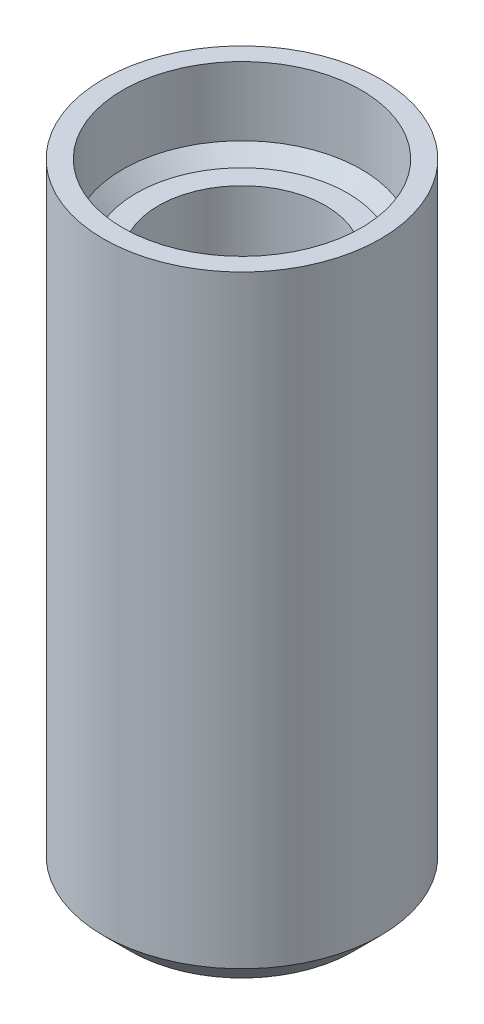
from build123d import *

# Parameters (mm, degrees)
SKETCH1_R           = 5.05
BOSS_EXTRUDE1_DEPTH = 20
SKETCH2_R           = 5.05
BOSS_EXTRUDE2_DEPTH = 2
SKETCH4_R           = 5.05
SKETCH4_R_2         = 4.35
BOSS_EXTRUDE3_DEPTH = 3
CHAMFER1_SIZE       = 1
CHAMFER2_SIZE       = 0.5
CUT_EXTRUDE1_DEPTH  = 0.4
BOSS_EXTRUDE4_DEPTH = 0.4


with BuildPart() as part:
    # Sketch1 → Boss-Extrude1 (new body)
    with BuildSketch(Plane(origin=(0, 0, 0), x_dir=(1, 0, 0), z_dir=(0, 1, 0))):
        Circle(SKETCH1_R)
        with BuildLine():
            Line((2.565151068, -1.65), (-2.565151068, -1.65))
            ThreePointArc((-2.565151068, -1.65), (0, 3.05), (2.565151068, -1.65))
        make_face(mode=Mode.SUBTRACT)
    extrude(amount=BOSS_EXTRUDE1_DEPTH)

    # Sketch2 → Boss-Extrude2 (add)
    with BuildSketch(Plane.XZ):
        Circle(SKETCH2_R)
    extrude(amount=-BOSS_EXTRUDE2_DEPTH)

    # Sketch4 → Boss-Extrude3 (add)
    with BuildSketch(Plane(origin=(0, 20, 0), x_dir=(1, 0, 0), z_dir=(0, 1, 0))):
        Circle(SKETCH4_R)
        Circle(SKETCH4_R_2, mode=Mode.SUBTRACT)
    extrude(amount=BOSS_EXTRUDE3_DEPTH)

    # Chamfer1
    chamfer1_edges = [part.edges().sort_by_distance(p)[0] for p in [
        (-5.05, 0, 0),
    ]]
    chamfer(chamfer1_edges, length=CHAMFER1_SIZE)

    # Chamfer2
    chamfer2_edges = [part.edges().sort_by_distance(p)[0] for p in [
        (-4.35, 20, 0),
    ]]
    chamfer(chamfer2_edges, length=CHAMFER2_SIZE)

    # Sketch5 → Cut-Extrude1 (cut)
    with BuildSketch(Plane.XZ):
        with BuildLine():
            add(Edge.make_bspline(
                [(1.439948587, -0.579050735), (1.438393197, -0.636125697), (1.435351129, -0.747754244), (1.412109355, -0.910724919), (1.373272888, -1.064316235), (1.318915978, -1.208054895), (1.251228015, -1.341503154), (1.168775155, -1.463629965), (1.075220295, -1.576249809), (0.967079513, -1.676505714), (0.847543719, -1.765655745), (0.716616536, -1.844185545), (0.574047546, -1.910923319), (0.420839367, -1.966886317), (0.257910597, -2.010815218), (0.085582122, -2.041361107), (-0.09520692, -2.060989849), (-0.218939729, -2.062982384), (-0.281989932, -2.063997715)],
                knots=[0, 0, 0, 0, 1.06697082, 2.086806491, 3.070914618, 4.02363306, 4.954656601, 5.862205625, 6.773556322, 7.686376441, 8.612568136, 9.557486927, 10.536112515, 11.55159642, 12.603902796, 13.687080049, 14.821411453, 16, 16, 16, 16], degree=3))
            add(Edge.make_bspline(
                [(-0.281989932, -2.063997715), (-0.348356836, -2.062827871), (-0.477649342, -2.060548843), (-0.665044022, -2.04349323), (-0.837747996, -2.016303457), (-0.992433846, -1.984355765), (-1.123968139, -1.94757722), (-1.217306518, -1.916285097), (-1.278293624, -1.892493495), (-1.312122515, -1.875368598), (-1.339664896, -1.861712222), (-1.363906932, -1.843835105), (-1.385501075, -1.820189227), (-1.404423487, -1.789260602), (-1.415744932, -1.75341174), (-1.426467821, -1.712510457), (-1.432590839, -1.662801927), (-1.438004466, -1.602800041), (-1.439033403, -1.531346414), (-1.439629456, -1.479681351), (-1.439948587, -1.452019566)],
                knots=[0, 0, 0, 0, 2.352153803, 4.582342044, 6.662667079, 8.546514862, 10.177514967, 11.500105838, 12.035421318, 12.4951253, 12.844003289, 13.122835489, 13.557570542, 13.970909211, 14.396887048, 14.884011341, 15.46879923, 16.168353294, 17.019325374, 18, 18, 18, 18], degree=3))
            add(Edge.make_bspline(
                [(-1.439948587, -1.452019566), (-1.439391637, -1.422021975), (-1.438376195, -1.367329788), (-1.435474416, -1.292072513), (-1.426872986, -1.23103092), (-1.41409825, -1.182479098), (-1.397910532, -1.14616854), (-1.378219461, -1.120833075), (-1.354577758, -1.1060704), (-1.33746784, -1.104709356), (-1.32895255, -1.10403199)],
                knots=[0, 0, 0, 0, 1.822902001, 3.323550125, 4.572139576, 5.559599618, 6.365772599, 6.969872283, 7.487324433, 8, 8, 8, 8], degree=3))
            add(Edge.make_bspline(
                [(-1.32895255, -1.10403199), (-1.314380115, -1.106692494), (-1.277664883, -1.113395629), (-1.219394697, -1.14876137), (-1.139980309, -1.189907738), (-1.037695887, -1.236395845), (-0.91190538, -1.281593663), (-0.791459343, -1.316487465), (-0.681740999, -1.338209641), (-0.588351478, -1.351644763), (-0.486730641, -1.357822159), (-0.416323331, -1.359273711), (-0.379986433, -1.36002285)],
                knots=[0, 0, 0, 0, 0.444011661, 1.118686809, 2.027427457, 3.152785246, 4.501835654, 6.058794642, 6.93060907, 7.875047181, 8.903321363, 10, 10, 10, 10], degree=3))
            add(Edge.make_bspline(
                [(-0.379986433, -1.36002285), (-0.31788032, -1.358275737), (-0.198485696, -1.354917036), (-0.053670925, -1.329255577), (0.051276255, -1.296118816), (0.123576356, -1.268409696), (0.188330585, -1.231138855), (0.247612541, -1.189342021), (0.301075979, -1.141322813), (0.346942768, -1.086622051), (0.387750954, -1.027445409), (0.420403557, -0.961544364), (0.448320421, -0.889922915), (0.466502796, -0.81112557), (0.477729401, -0.725703442), (0.479211121, -0.666752696), (0.479982862, -0.6360487)],
                knots=[0, 0, 0, 0, 2.032782473, 3.907880992, 4.788067796, 5.635158135, 6.436515337, 7.226873511, 8.007222909, 8.781366493, 9.559270127, 10.354810048, 11.183780612, 12.070505633, 12.995039183, 14, 14, 14, 14], degree=3))
            add(Edge.make_bspline(
                [(0.479982862, -0.6360487), (0.479412985, -0.6093624), (0.478305392, -0.557495903), (0.469563532, -0.482034449), (0.453177222, -0.411500625), (0.431432346, -0.344900313), (0.402538508, -0.283128781), (0.366916596, -0.225828092), (0.324085716, -0.17377282), (0.272905228, -0.127675559), (0.215793236, -0.084689087), (0.149399045, -0.049317465), (0.075561613, -0.019325372), (-0.005965992, 0.005981896), (-0.096158935, 0.024190829), (-0.194931474, 0.038548679), (-0.302874198, 0.046046446), (-0.377976858, 0.047284062), (-0.416985112, 0.047926879)],
                knots=[0, 0, 0, 0, 0.990747943, 1.925580712, 2.814217929, 3.675193293, 4.522270198, 5.339531786, 6.174590224, 7.015406179, 7.891633713, 8.822032467, 9.798768499, 10.847855848, 11.98621392, 13.211340836, 14.551572957, 16, 16, 16, 16], degree=3))
            add(Edge.make_bspline(
                [(-0.416985112, 0.047926879), (-0.478702682, 0.047210663), (-0.596668893, 0.045841696), (-0.765068195, 0.028934291), (-0.919926324, 0.01066173), (-1.019577939, 0.008821699), (-1.067961869, 0.007928307)],
                knots=[0, 0, 0, 0, 1.134417109, 2.168311031, 3.110658559, 4, 4, 4, 4], degree=3))
            add(Edge.make_bspline(
                [(-1.067961869, 0.007928307), (-1.083020531, 0.008392878), (-1.111118239, 0.009259712), (-1.150138262, 0.018431019), (-1.182818227, 0.032872851), (-1.209177811, 0.05548653), (-1.226922392, 0.087363767), (-1.240169466, 0.127638843), (-1.245874592, 0.177776437), (-1.2472265, 0.21425253), (-1.247955442, 0.233920238)],
                knots=[0, 0, 0, 0, 1.070487309, 1.997404571, 2.836260287, 3.593209122, 4.423627128, 5.399401485, 6.59777159, 8, 8, 8, 8], degree=3))
            Line((-1.247955442, 0.233920238), (-1.247955442, 2.102853508))
            add(Edge.make_bspline(
                [(-1.247955442, 2.102853508), (-1.247599976, 2.123576244), (-1.246941269, 2.16197712), (-1.236732112, 2.214876364), (-1.221311877, 2.259127895), (-1.197941013, 2.294775722), (-1.165564434, 2.320945401), (-1.126711766, 2.339974478), (-1.079383337, 2.349443274), (-1.045997006, 2.351002434), (-1.027963297, 2.351844618)],
                knots=[0, 0, 0, 0, 1.291048597, 2.392415675, 3.346680984, 4.200455207, 5.012683301, 5.914987328, 6.873775246, 8, 8, 8, 8], degree=3))
            Line((-1.027963297, 2.351844618), (1.04496269, 2.351844618))
            add(Edge.make_bspline(
                [(1.04496269, 2.351844618), (1.055190007, 2.350926617), (1.076261775, 2.349035221), (1.104894282, 2.331034015), (1.131333877, 2.304065643), (1.150121646, 2.263110254), (1.16654453, 2.210872955), (1.176134645, 2.144447296), (1.183468776, 2.063693255), (1.183785339, 2.004883661), (1.183957727, 1.97285815)],
                knots=[0, 0, 0, 0, 0.553923566, 1.141271771, 1.798199546, 2.596456404, 3.569952235, 4.788584081, 6.251182718, 8, 8, 8, 8], degree=3))
            add(Edge.make_bspline(
                [(1.183957727, 1.97285815), (1.183729472, 1.941175572), (1.183303526, 1.882052545), (1.176380949, 1.800537041), (1.165959332, 1.732820566), (1.151442781, 1.678865964), (1.132612223, 1.636851912), (1.108692381, 1.606959559), (1.079866993, 1.587443271), (1.058560376, 1.585058307), (1.047962583, 1.583872038)],
                knots=[0, 0, 0, 0, 1.705538939, 3.182715304, 4.401402576, 5.39006858, 6.184910218, 6.860567929, 7.433252789, 8, 8, 8, 8], degree=3))
            Line((1.047962583, 1.583872038), (-0.479982862, 1.583872038))
            Line((-0.479982862, 1.583872038), (-0.479982862, 0.667904743))
            add(Edge.make_bspline(
                [(-0.479982862, 0.667904743), (-0.441346593, 0.671918223), (-0.364857454, 0.679863805), (-0.248720081, 0.685708044), (-0.130332428, 0.686983289), (-0.049998012, 0.687592911), (-0.008999679, 0.687904029)],
                knots=[0, 0, 0, 0, 0.98809062, 1.956146446, 2.956927895, 4, 4, 4, 4], degree=3))
            add(Edge.make_bspline(
                [(-0.008999679, 0.687904029), (0.047360881, 0.686958258), (0.157291086, 0.68511355), (0.317154001, 0.670422458), (0.467180499, 0.644188125), (0.607480319, 0.608622662), (0.737597185, 0.56258046), (0.858039732, 0.507710012), (0.967040457, 0.441818615), (1.064846172, 0.365836383), (1.152941218, 0.282029844), (1.228161184, 0.186488915), (1.293613642, 0.082555145), (1.346679341, -0.031843243), (1.388761263, -0.155148579), (1.418518229, -0.288234642), (1.436738318, -0.430548976), (1.438859317, -0.528662904), (1.439948587, -0.579050735)],
                knots=[0, 0, 0, 0, 1.233638519, 2.406188574, 3.509786213, 4.564519873, 5.570688591, 6.527218667, 7.456964246, 8.351604632, 9.23399176, 10.111417538, 11.006266177, 11.916948856, 12.865290053, 13.852981671, 14.897367593, 16, 16, 16, 16], degree=3))
        make_face()
    extrude(amount=-CUT_EXTRUDE1_DEPTH, mode=Mode.SUBTRACT)


with BuildPart() as body_2:
    # Sketch5<2> → Boss-Extrude4 (new body)
    with BuildSketch(Plane.XZ):
        with BuildLine():
            add(Edge.make_bspline(
                [(1.439948587, -0.579050735), (1.438393197, -0.636125697), (1.435351129, -0.747754244), (1.412109355, -0.910724919), (1.373272888, -1.064316235), (1.318915978, -1.208054895), (1.251228015, -1.341503154), (1.168775155, -1.463629965), (1.075220295, -1.576249809), (0.967079513, -1.676505714), (0.847543719, -1.765655745), (0.716616536, -1.844185545), (0.574047546, -1.910923319), (0.420839367, -1.966886317), (0.257910597, -2.010815218), (0.085582122, -2.041361107), (-0.09520692, -2.060989849), (-0.218939729, -2.062982384), (-0.281989932, -2.063997715)],
                knots=[0, 0, 0, 0, 1.06697082, 2.086806491, 3.070914618, 4.02363306, 4.954656601, 5.862205625, 6.773556322, 7.686376441, 8.612568136, 9.557486927, 10.536112515, 11.55159642, 12.603902796, 13.687080049, 14.821411453, 16, 16, 16, 16], degree=3))
            add(Edge.make_bspline(
                [(-0.281989932, -2.063997715), (-0.348356836, -2.062827871), (-0.477649342, -2.060548843), (-0.665044022, -2.04349323), (-0.837747996, -2.016303457), (-0.992433846, -1.984355765), (-1.123968139, -1.94757722), (-1.217306518, -1.916285097), (-1.278293624, -1.892493495), (-1.312122515, -1.875368598), (-1.339664896, -1.861712222), (-1.363906932, -1.843835105), (-1.385501075, -1.820189227), (-1.404423487, -1.789260602), (-1.415744932, -1.75341174), (-1.426467821, -1.712510457), (-1.432590839, -1.662801927), (-1.438004466, -1.602800041), (-1.439033403, -1.531346414), (-1.439629456, -1.479681351), (-1.439948587, -1.452019566)],
                knots=[0, 0, 0, 0, 2.352153803, 4.582342044, 6.662667079, 8.546514862, 10.177514967, 11.500105838, 12.035421318, 12.4951253, 12.844003289, 13.122835489, 13.557570542, 13.970909211, 14.396887048, 14.884011341, 15.46879923, 16.168353294, 17.019325374, 18, 18, 18, 18], degree=3))
            add(Edge.make_bspline(
                [(-1.439948587, -1.452019566), (-1.439391637, -1.422021975), (-1.438376195, -1.367329788), (-1.435474416, -1.292072513), (-1.426872986, -1.23103092), (-1.41409825, -1.182479098), (-1.397910532, -1.14616854), (-1.378219461, -1.120833075), (-1.354577758, -1.1060704), (-1.33746784, -1.104709356), (-1.32895255, -1.10403199)],
                knots=[0, 0, 0, 0, 1.822902001, 3.323550125, 4.572139576, 5.559599618, 6.365772599, 6.969872283, 7.487324433, 8, 8, 8, 8], degree=3))
            add(Edge.make_bspline(
                [(-1.32895255, -1.10403199), (-1.314380115, -1.106692494), (-1.277664883, -1.113395629), (-1.219394697, -1.14876137), (-1.139980309, -1.189907738), (-1.037695887, -1.236395845), (-0.91190538, -1.281593663), (-0.791459343, -1.316487465), (-0.681740999, -1.338209641), (-0.588351478, -1.351644763), (-0.486730641, -1.357822159), (-0.416323331, -1.359273711), (-0.379986433, -1.36002285)],
                knots=[0, 0, 0, 0, 0.444011661, 1.118686809, 2.027427457, 3.152785246, 4.501835654, 6.058794642, 6.93060907, 7.875047181, 8.903321363, 10, 10, 10, 10], degree=3))
            add(Edge.make_bspline(
                [(-0.379986433, -1.36002285), (-0.31788032, -1.358275737), (-0.198485696, -1.354917036), (-0.053670925, -1.329255577), (0.051276255, -1.296118816), (0.123576356, -1.268409696), (0.188330585, -1.231138855), (0.247612541, -1.189342021), (0.301075979, -1.141322813), (0.346942768, -1.086622051), (0.387750954, -1.027445409), (0.420403557, -0.961544364), (0.448320421, -0.889922915), (0.466502796, -0.81112557), (0.477729401, -0.725703442), (0.479211121, -0.666752696), (0.479982862, -0.6360487)],
                knots=[0, 0, 0, 0, 2.032782473, 3.907880992, 4.788067796, 5.635158135, 6.436515337, 7.226873511, 8.007222909, 8.781366493, 9.559270127, 10.354810048, 11.183780612, 12.070505633, 12.995039183, 14, 14, 14, 14], degree=3))
            add(Edge.make_bspline(
                [(0.479982862, -0.6360487), (0.479412985, -0.6093624), (0.478305392, -0.557495903), (0.469563532, -0.482034449), (0.453177222, -0.411500625), (0.431432346, -0.344900313), (0.402538508, -0.283128781), (0.366916596, -0.225828092), (0.324085716, -0.17377282), (0.272905228, -0.127675559), (0.215793236, -0.084689087), (0.149399045, -0.049317465), (0.075561613, -0.019325372), (-0.005965992, 0.005981896), (-0.096158935, 0.024190829), (-0.194931474, 0.038548679), (-0.302874198, 0.046046446), (-0.377976858, 0.047284062), (-0.416985112, 0.047926879)],
                knots=[0, 0, 0, 0, 0.990747943, 1.925580712, 2.814217929, 3.675193293, 4.522270198, 5.339531786, 6.174590224, 7.015406179, 7.891633713, 8.822032467, 9.798768499, 10.847855848, 11.98621392, 13.211340836, 14.551572957, 16, 16, 16, 16], degree=3))
            add(Edge.make_bspline(
                [(-0.416985112, 0.047926879), (-0.478702682, 0.047210663), (-0.596668893, 0.045841696), (-0.765068195, 0.028934291), (-0.919926324, 0.01066173), (-1.019577939, 0.008821699), (-1.067961869, 0.007928307)],
                knots=[0, 0, 0, 0, 1.134417109, 2.168311031, 3.110658559, 4, 4, 4, 4], degree=3))
            add(Edge.make_bspline(
                [(-1.067961869, 0.007928307), (-1.083020531, 0.008392878), (-1.111118239, 0.009259712), (-1.150138262, 0.018431019), (-1.182818227, 0.032872851), (-1.209177811, 0.05548653), (-1.226922392, 0.087363767), (-1.240169466, 0.127638843), (-1.245874592, 0.177776437), (-1.2472265, 0.21425253), (-1.247955442, 0.233920238)],
                knots=[0, 0, 0, 0, 1.070487309, 1.997404571, 2.836260287, 3.593209122, 4.423627128, 5.399401485, 6.59777159, 8, 8, 8, 8], degree=3))
            Line((-1.247955442, 0.233920238), (-1.247955442, 2.102853508))
            add(Edge.make_bspline(
                [(-1.247955442, 2.102853508), (-1.247599976, 2.123576244), (-1.246941269, 2.16197712), (-1.236732112, 2.214876364), (-1.221311877, 2.259127895), (-1.197941013, 2.294775722), (-1.165564434, 2.320945401), (-1.126711766, 2.339974478), (-1.079383337, 2.349443274), (-1.045997006, 2.351002434), (-1.027963297, 2.351844618)],
                knots=[0, 0, 0, 0, 1.291048597, 2.392415675, 3.346680984, 4.200455207, 5.012683301, 5.914987328, 6.873775246, 8, 8, 8, 8], degree=3))
            Line((-1.027963297, 2.351844618), (1.04496269, 2.351844618))
            add(Edge.make_bspline(
                [(1.04496269, 2.351844618), (1.055190007, 2.350926617), (1.076261775, 2.349035221), (1.104894282, 2.331034015), (1.131333877, 2.304065643), (1.150121646, 2.263110254), (1.16654453, 2.210872955), (1.176134645, 2.144447296), (1.183468776, 2.063693255), (1.183785339, 2.004883661), (1.183957727, 1.97285815)],
                knots=[0, 0, 0, 0, 0.553923566, 1.141271771, 1.798199546, 2.596456404, 3.569952235, 4.788584081, 6.251182718, 8, 8, 8, 8], degree=3))
            add(Edge.make_bspline(
                [(1.183957727, 1.97285815), (1.183729472, 1.941175572), (1.183303526, 1.882052545), (1.176380949, 1.800537041), (1.165959332, 1.732820566), (1.151442781, 1.678865964), (1.132612223, 1.636851912), (1.108692381, 1.606959559), (1.079866993, 1.587443271), (1.058560376, 1.585058307), (1.047962583, 1.583872038)],
                knots=[0, 0, 0, 0, 1.705538939, 3.182715304, 4.401402576, 5.39006858, 6.184910218, 6.860567929, 7.433252789, 8, 8, 8, 8], degree=3))
            Line((1.047962583, 1.583872038), (-0.479982862, 1.583872038))
            Line((-0.479982862, 1.583872038), (-0.479982862, 0.667904743))
            add(Edge.make_bspline(
                [(-0.479982862, 0.667904743), (-0.441346593, 0.671918223), (-0.364857454, 0.679863805), (-0.248720081, 0.685708044), (-0.130332428, 0.686983289), (-0.049998012, 0.687592911), (-0.008999679, 0.687904029)],
                knots=[0, 0, 0, 0, 0.98809062, 1.956146446, 2.956927895, 4, 4, 4, 4], degree=3))
            add(Edge.make_bspline(
                [(-0.008999679, 0.687904029), (0.047360881, 0.686958258), (0.157291086, 0.68511355), (0.317154001, 0.670422458), (0.467180499, 0.644188125), (0.607480319, 0.608622662), (0.737597185, 0.56258046), (0.858039732, 0.507710012), (0.967040457, 0.441818615), (1.064846172, 0.365836383), (1.152941218, 0.282029844), (1.228161184, 0.186488915), (1.293613642, 0.082555145), (1.346679341, -0.031843243), (1.388761263, -0.155148579), (1.418518229, -0.288234642), (1.436738318, -0.430548976), (1.438859317, -0.528662904), (1.439948587, -0.579050735)],
                knots=[0, 0, 0, 0, 1.233638519, 2.406188574, 3.509786213, 4.564519873, 5.570688591, 6.527218667, 7.456964246, 8.351604632, 9.23399176, 10.111417538, 11.006266177, 11.916948856, 12.865290053, 13.852981671, 14.897367593, 16, 16, 16, 16], degree=3))
        make_face()
    extrude(amount=-BOSS_EXTRUDE4_DEPTH)


solid = Compound([part.part, body_2.part])
